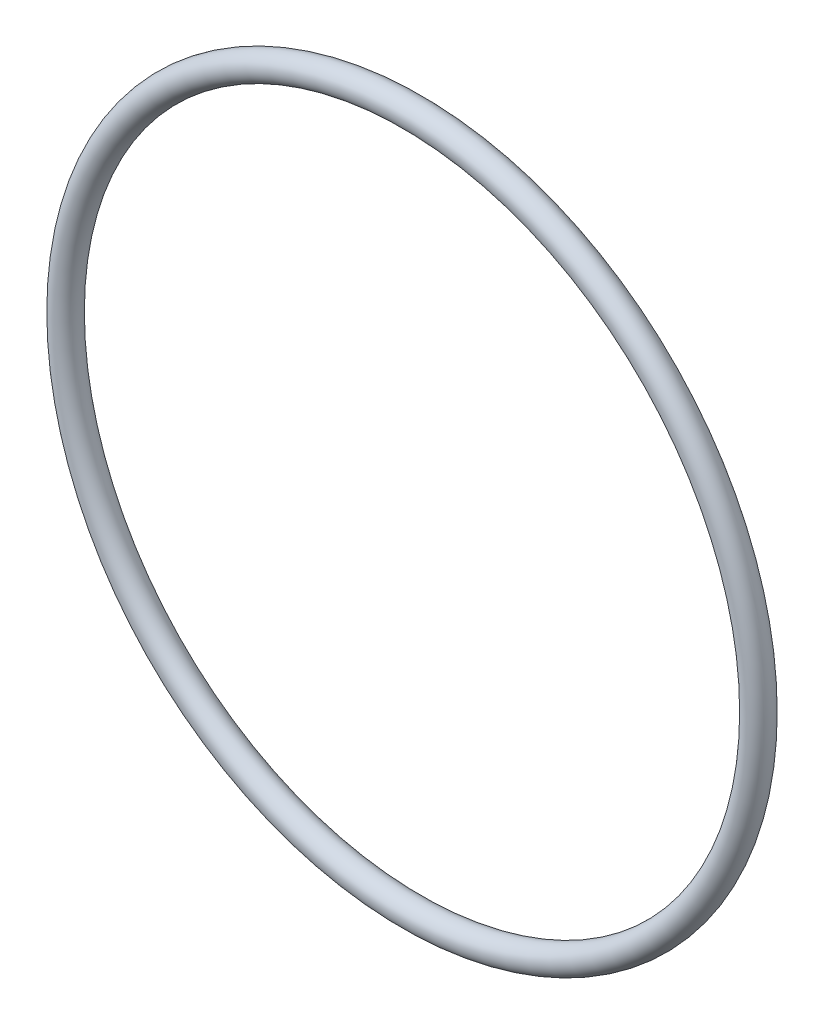
from build123d import *

# Parameters (mm, degrees)
SKETCH1_R = 1.7653


with BuildPart() as part:
    # Sketch1 → Revolve1 (revolve)
    with BuildSketch(Plane(origin=(0, 0, 0), x_dir=(0, -1, 0), z_dir=(1, 0, 0)), mode=Mode.PRIVATE) as revolve1_sk:
        with Locations((46.0121, 0)):
            Circle(SKETCH1_R)
    revolve(revolve1_sk.sketch.rotate(Axis((0, 0, 1.7653), (0, 0, -1)), 270), axis=Axis((0, 0, 1.7653), (0, 0, -1)))


solid = part.part
